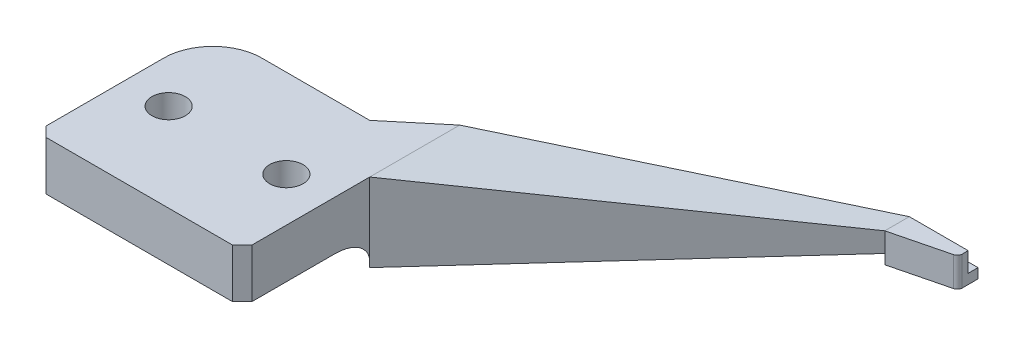
from build123d import *

# Parameters (mm, degrees)
SKETCH_2_W          = 21
SKETCH_2_H          = 18
EXTRUDE_2_DEPTH     = 5
EXTRUDE_3_DEPTH     = 9
SKETCH_4_W          = 30
SKETCH_4_H          = 1
CUT_EXTRUDE_1_DEPTH = 60.968741858
FILLET_1_R          = 0.5
FILLET_2_R          = 2.5
FILLET_3_R          = 5
CHAMFER_1_SIZE      = 1
SKETCH_5_R          = 1.7
CUT_EXTRUDE_2_DEPTH = 55.398988961
SKETCH_6_W          = 6
SKETCH_6_H          = 1
EXTRUDE_4_DEPTH     = 1


with BuildPart() as part:
    # ｽｹｯﾁ2 → ﾎﾞｽ - 押し出し2 (new body)
    with BuildSketch(Plane(origin=(0, 0, 0), x_dir=(1, 0, 0), z_dir=(0, 1, 0))):
        Rectangle(SKETCH_2_W, SKETCH_2_H)
    extrude(amount=EXTRUDE_2_DEPTH)

    # ｽｹｯﾁ3 → ﾎﾞｽ - 押し出し3 (add)
    with BuildSketch(Plane(origin=(0, -4, 0), x_dir=(-1, 0, 0), z_dir=(0, -1, 0))):
        Polygon((-5.5, 9), (-35.5, 34), (-41.5, 34), (-41.5, 33), (-35.5, 31.5), (-10.5, 4), align=None)
    extrude(amount=-EXTRUDE_3_DEPTH)

    # ｽｹｯﾁ4 → ｶｯﾄ - 押し出し1 (cut, through all)
    with BuildSketch(Plane.XY.offset(9)):
        Polygon((35.5, -1), (10.5, 5), (41.5, 5), (41.5, -1), align=None)
        with Locations((20.5, -3.5)):
            Rectangle(SKETCH_4_W, SKETCH_4_H)
    extrude(amount=-CUT_EXTRUDE_1_DEPTH, mode=Mode.SUBTRACT)

    # ﾌｨﾚｯﾄ1
    fillet_1_edges = [part.edges().sort_by_distance(p)[0] for p in [
        (41.5, -2.5, -33),
    ]]
    fillet(fillet_1_edges, radius=FILLET_1_R)

    # ﾌｨﾚｯﾄ2
    fillet_2_edges = [part.edges().sort_by_distance(p)[0] for p in [
        (8, 0, -6.5),
    ]]
    fillet(fillet_2_edges, radius=FILLET_2_R)

    # ﾌｨﾚｯﾄ3
    fillet_3_edges = [part.edges().sort_by_distance(p)[0] for p in [
        (-10.5, 2.5, -9),
    ]]
    fillet(fillet_3_edges, radius=FILLET_3_R)

    # 面取り1
    chamfer_1_edges = [part.edges().sort_by_distance(p)[0] for p in [
        (10.5, 2.5, 9),
        (-10.5, 2.5, 9),
    ]]
    chamfer(chamfer_1_edges, length=CHAMFER_1_SIZE)

    # ｽｹｯﾁ5 → ｶｯﾄ - 押し出し2 (cut, through all)
    with BuildSketch(Plane(origin=(0, 5, 0), x_dir=(1, 0, 0), z_dir=(0, 1, 0))):
        with Locations(Location((6, 0, 0), (0, 0, 270))):
            Circle(SKETCH_5_R)
        with Locations(Location((-6, 0, 0), (0, 0, 270))):
            Circle(SKETCH_5_R)
    extrude(amount=-CUT_EXTRUDE_2_DEPTH, mode=Mode.SUBTRACT)

    # ｽｹｯﾁ6 → ﾎﾞｽ - 押し出し4 (add)
    with BuildSketch(Plane(origin=(0, 0, -34), x_dir=(-1, 0, 0), z_dir=(0, 0, -1))):
        with Locations((-38.5, -3.5)):
            Rectangle(SKETCH_6_W, SKETCH_6_H)
    extrude(amount=EXTRUDE_4_DEPTH)


solid = part.part
